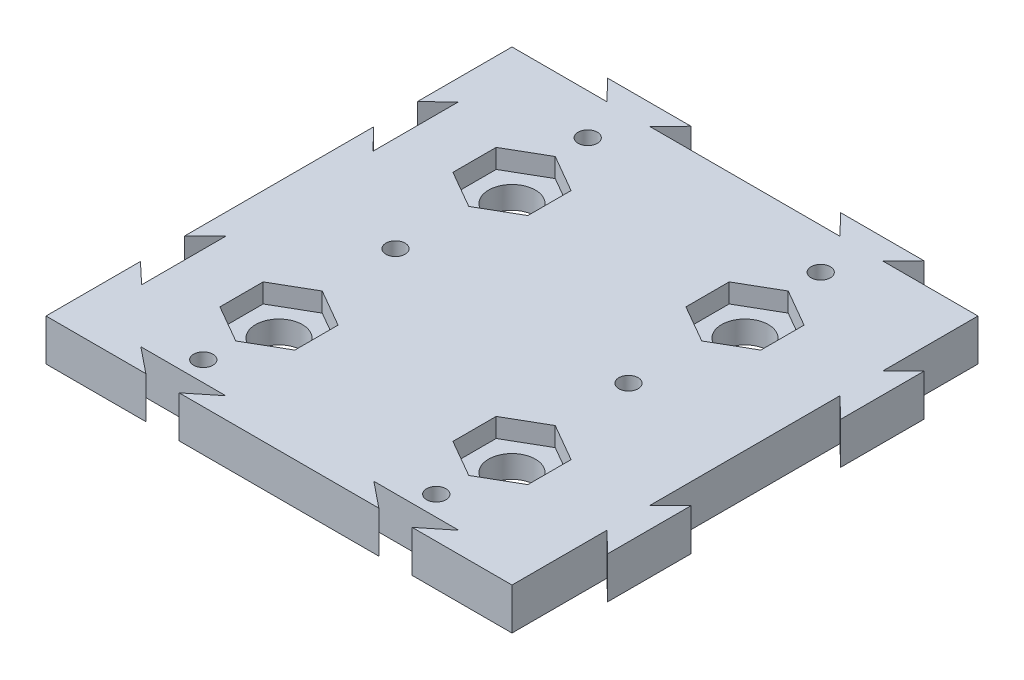
from build123d import *

# Parameters (mm, degrees)
SKETCH1_W             = 35.56
SKETCH1_H             = 35.56
BOSS_EXTRUDE1_DEPTH   = 6.35
CUT_EXTRUDE1_DEPTH    = 2.921
LPATTERN11_COUNT      = 2
LPATTERN11_PITCH      = 35.56
LPATTERN11_COUNT_DIR2 = 2
LPATTERN11_PITCH_DIR2 = 35.56
LPATTERN15_COUNT      = 2
LPATTERN15_PITCH      = 35.56
LPATTERN16_COUNT      = 2
LPATTERN16_PITCH      = 35.56
SKETCH20_W            = 3.175
SKETCH20_H            = 12.7
BOSS_EXTRUDE2_DEPTH   = 6.35
CUT_EXTRUDE2_DEPTH    = 76.700949135
SKETCH22_W            = 12.7
SKETCH22_H            = 3.175
BOSS_EXTRUDE3_DEPTH   = 6.35
CUT_EXTRUDE3_DEPTH    = 78.97065682
CUT_EXTRUDE4_DEPTH    = 78.97065682
CUT_EXTRUDE5_DEPTH    = 78.97065682
BOSS_EXTRUDE4_DEPTH   = 6.35
SKETCH27_W            = 71.12
SKETCH27_H            = 6.802519952
CUT_EXTRUDE6_DEPTH    = 78.97065682


with BuildPart() as part:
    # Sketch1 → Boss-Extrude1 (new body)
    with BuildSketch(Plane(origin=(0, 0, 0), x_dir=(1, 0, 0), z_dir=(0, 1, 0))):
        Rectangle(SKETCH1_W, SKETCH1_H)
    boss_extrude1 = extrude(amount=BOSS_EXTRUDE1_DEPTH)

    # Sketch2 → Cut-Extrude1 (cut)
    with BuildSketch(Plane(origin=(0, 6.35, 0), x_dir=(1, 0, 0), z_dir=(0, 1, 0))):
        Polygon((0, 6.599113577), (-5.715, 3.299556788), (-5.715, -3.299556788), (0, -6.599113577), (5.715, -3.299556788), (5.715, 3.299556788), align=None)
    cut_extrude1 = extrude(amount=-CUT_EXTRUDE1_DEPTH, mode=Mode.SUBTRACT)

    # Sketch3 → 1/4 Clearance Hole1 (revolve, cut)
    with BuildSketch(Plane(origin=(0, 3.429, 0), x_dir=(0, 0, 1), z_dir=(1, 0, 0))):
        Polygon((0, 0), (0, 11.035817477), (3.57124, 8.89), (3.57124, 0), align=None)
    f_1_4_clearance_hole1 = revolve(axis=Axis((0, 9.779, 0), (0, -1, 0)), mode=Mode.SUBTRACT)

    # LPattern11: Boss-Extrude1, Cut-Extrude1, 1_4 Clearance Hole1 2 × 2
    with Locations(*[(-j * LPATTERN11_PITCH_DIR2, 0, i * LPATTERN11_PITCH) for i in range(LPATTERN11_COUNT) for j in range(LPATTERN11_COUNT_DIR2) if (i, j) != (0, 0)]):
        add(boss_extrude1)
        add(cut_extrude1, mode=Mode.SUBTRACT)
        add(f_1_4_clearance_hole1, mode=Mode.SUBTRACT)

    # Sketch15 → CBORE for #4 Socket Head Cap Screw5 (revolve, cut)
    with BuildSketch(Plane(origin=(0, 0, -11.557), x_dir=(0, 0, -1), z_dir=(1, 0, 0))):
        Polygon((0, 0), (0, 9.775187864), (1.4732, 8.89), (1.4732, 3.81), (2.794, 3.81), (2.794, 0), align=None)
    cbore_for_4_socket_head_cap_screw5 = revolve(axis=Axis((0, -6.35, -11.557), (0, 1, 0)), mode=Mode.SUBTRACT)

    # LPattern15: CBORE for #4 Socket Head Cap Screw5 ×2
    with Locations(*[(-i * LPATTERN15_PITCH, 0, 0) for i in range(1, LPATTERN15_COUNT)]):
        add(cbore_for_4_socket_head_cap_screw5, mode=Mode.SUBTRACT)

    # Sketch17 → CBORE for #4 Socket Head Cap Screw6 (revolve, cut)
    with BuildSketch(Plane(origin=(0, 0, 17.78), x_dir=(0, 0, -1), z_dir=(1, 0, 0))):
        Polygon((0, 0), (0, 9.775187864), (1.4732, 8.89), (1.4732, 3.81), (2.794, 3.81), (2.794, 0), align=None)
    cbore_for_4_socket_head_cap_screw6 = revolve(axis=Axis((0, -6.35, 17.78), (0, 1, 0)), mode=Mode.SUBTRACT)

    # LPattern16: CBORE for #4 Socket Head Cap Screw6 ×2
    with Locations(*[(-i * LPATTERN16_PITCH, 0, 0) for i in range(1, LPATTERN16_COUNT)]):
        add(cbore_for_4_socket_head_cap_screw6, mode=Mode.SUBTRACT)

    # Mirror1: CBORE for #4 Socket Head Cap Screw5 across plane
    add(cbore_for_4_socket_head_cap_screw5.mirror(Plane.XY.offset(17.78)), mode=Mode.SUBTRACT)

    # Mirror1 copy 1 sketch → Mirror1 copy 1 (revolve, cut)
    with BuildSketch(Plane(origin=(-35.56, 0, 47.117), x_dir=(0, 0, 1), z_dir=(1, 0, 0))):
        Polygon((0, 0), (0, -9.775187864), (1.4732, -8.89), (1.4732, -3.81), (2.794, -3.81), (2.794, 0), align=None)
    revolve(axis=Axis((-35.56, -6.35, 47.117), (0, -1, 0)), mode=Mode.SUBTRACT)

    # Sketch20 → Boss-Extrude2 (add)
    with BuildSketch(Plane(origin=(0, 0, 0), x_dir=(1, 0, 0), z_dir=(0, 1, 0))):
        with Locations((19.3675, 0)):
            Rectangle(SKETCH20_W, SKETCH20_H)
        with Locations((19.3675, -35.56)):
            Rectangle(SKETCH20_W, SKETCH20_H)
    extrude(amount=BOSS_EXTRUDE2_DEPTH)

    # Sketch21 → Cut-Extrude2 (cut, through all)
    with BuildSketch(Plane(origin=(0, 6.35, 0), x_dir=(1, 0, 0), z_dir=(0, 1, 0))):
        Polygon((20.955, -6.35), (17.78, -6.35), (17.78, -3.302), align=None)
        Polygon((20.955, 6.35), (17.78, 6.35), (17.78, 3.302), align=None)
        Polygon((20.955, -29.21), (17.78, -29.21), (17.78, -32.258), align=None)
        Polygon((20.955, -41.91), (17.78, -41.91), (17.78, -38.862), align=None)
    extrude(amount=-CUT_EXTRUDE2_DEPTH, mode=Mode.SUBTRACT)

    # Sketch22 → Boss-Extrude3 (add)
    with BuildSketch(Plane(origin=(0, 0, 0), x_dir=(1, 0, 0), z_dir=(0, 1, 0))):
        with Locations((-35.56, -54.9275)):
            Rectangle(SKETCH22_W, SKETCH22_H)
        with Locations((0, -54.9275)):
            Rectangle(SKETCH22_W, SKETCH22_H)
    boss_extrude3 = extrude(amount=BOSS_EXTRUDE3_DEPTH)

    # Sketch23 → Cut-Extrude3 (cut, through all)
    with BuildSketch(Plane(origin=(0, 6.35, 0), x_dir=(1, 0, 0), z_dir=(0, 1, 0))):
        Polygon((-41.91, -56.515), (-41.91, -53.34), (-38.862, -53.34), align=None)
        Polygon((-29.21, -56.515), (-29.21, -53.34), (-32.258, -53.34), align=None)
        Polygon((-6.35, -56.515), (-6.35, -53.34), (-3.302, -53.34), align=None)
        Polygon((6.35, -56.515), (6.35, -53.34), (3.302, -53.34), align=None)
    cut_extrude3 = extrude(amount=-CUT_EXTRUDE3_DEPTH, mode=Mode.SUBTRACT)

    # Sketch24 → Cut-Extrude4 (cut, through all)
    with BuildSketch(Plane(origin=(0, 6.35, 0), x_dir=(1, 0, 0), z_dir=(0, 1, 0))):
        Polygon((-53.34, 3.3655), (-53.34, -3.3655), (-50.165, -6.5913), (-50.165, 6.3627), align=None)
    cut_extrude4 = extrude(amount=-CUT_EXTRUDE4_DEPTH, mode=Mode.SUBTRACT)

    # Mirror2: Cut-Extrude4 across plane
    add(cut_extrude4.mirror(Plane.XY.offset(17.78)), mode=Mode.SUBTRACT)

    # Sketch25 → Cut-Extrude5 (cut, through all)
    with BuildSketch(Plane(origin=(0, 6.35, 0), x_dir=(1, 0, 0), z_dir=(0, 1, 0))):
        Polygon((-38.1, 17.78), (-33.02, 17.78), (-29.083, 14.605), (-42.037, 14.605), align=None)
        Polygon((-2.54, 17.78), (2.54, 17.78), (6.477, 14.605), (-6.477, 14.605), align=None)
    cut_extrude5 = extrude(amount=-CUT_EXTRUDE5_DEPTH, mode=Mode.SUBTRACT)

    # Mirror3: Boss-Extrude3, Cut-Extrude3, Cut-Extrude5 across plane
    add(boss_extrude3.mirror(Plane.XY.offset(17.78)))
    add(cut_extrude3.mirror(Plane.XY.offset(17.78)), mode=Mode.SUBTRACT)
    add(cut_extrude5.mirror(Plane.XY.offset(17.78)), mode=Mode.SUBTRACT)

    # Sketch26 → Boss-Extrude4 (add)
    with BuildSketch(Plane(origin=(0, 6.35, 0), x_dir=(1, 0, 0), z_dir=(0, 1, 0))):
        Polygon((-29.083, 14.605), (-33.02, 17.78), (-38.1, 17.78), (-42.037, 14.605), align=None)
        Polygon((-6.477, 14.605), (6.477, 14.605), (2.54, 17.78), (-2.54, 17.78), align=None)
    extrude(amount=-BOSS_EXTRUDE4_DEPTH)

    # Sketch27 → Cut-Extrude6 (cut, through all)
    with BuildSketch(Plane(origin=(0, 6.35, 0), x_dir=(1, 0, 0), z_dir=(0, 1, 0))):
        with Locations((-17.78, -56.741259976)):
            Rectangle(SKETCH27_W, SKETCH27_H)
    extrude(amount=-CUT_EXTRUDE6_DEPTH, mode=Mode.SUBTRACT)


solid = part.part
